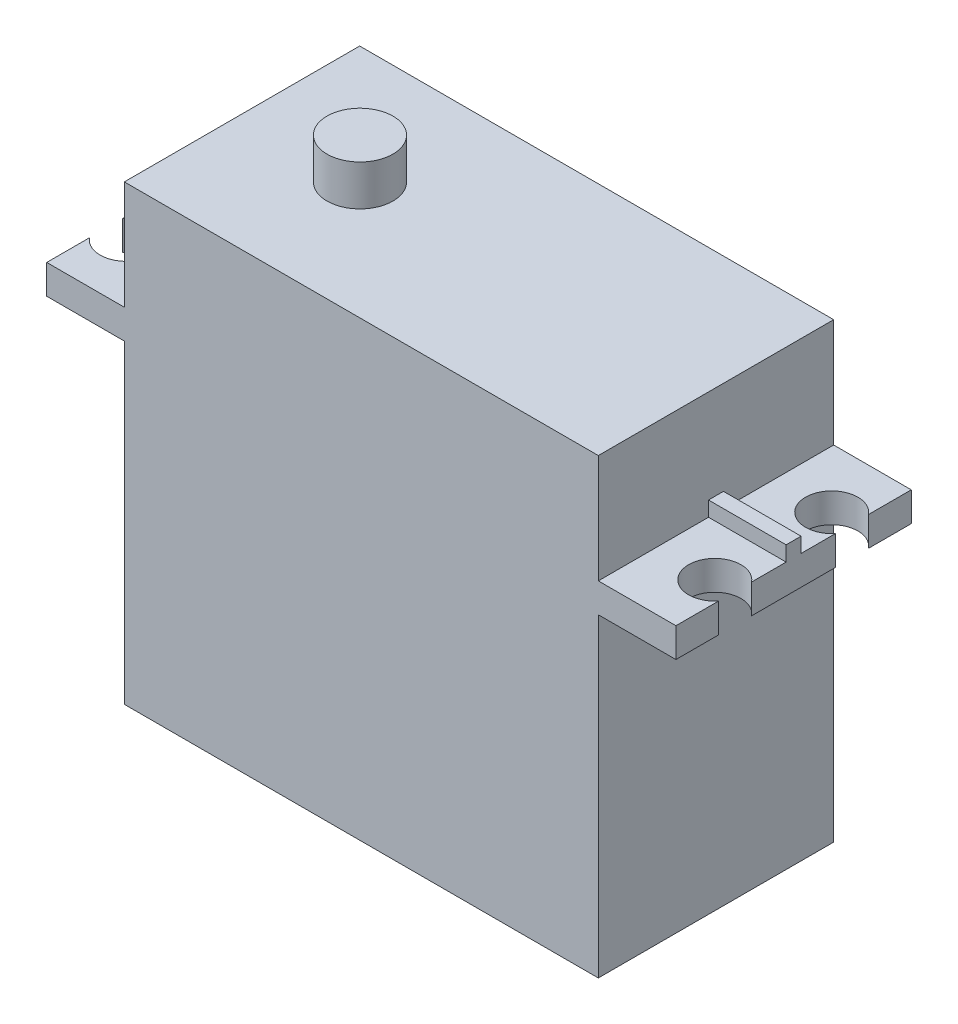
from build123d import *

# Parameters (mm, degrees)
SKETCH2_W               = 40.259
SKETCH2_H               = 19.9898
TOP_OF_HOUSING_DEPTH    = 9.2202
OUTER_EDGE_OF_MOTOR_W   = 53.4416
OUTER_EDGE_OF_MOTOR_H   = 19.9898
MOUNTING_FIN_DEPTH      = 2.4892
SKETCH4_R               = 2.2225
MOUNTING_HOLES_DEPTH    = 30.981848954
SKETCH5_R               = 2.799999988
C24T_SPLINE_DEPTH       = 3.4544
SKETCH2_2_W             = 40.259
SKETCH2_2_H             = 19.9898
BOTTOM_OF_HOUSING_DEPTH = 29.21
SKETCH6_W               = 6.5913
SKETCH6_H               = 1.27
NUB_DEPTH               = 1.27


with BuildPart() as part:
    # Sketch2 → Top of Housing (new body)
    with BuildSketch(Plane(origin=(0, 0, 0), x_dir=(1, 0, 0), z_dir=(0, 1, 0))):
        Rectangle(SKETCH2_W, SKETCH2_H)
    extrude(amount=TOP_OF_HOUSING_DEPTH)

    # Outer Edge of Motor → Mounting Fin (add)
    with BuildSketch(Plane(origin=(0, 0, 0), x_dir=(1, 0, 0), z_dir=(0, 1, 0))):
        Rectangle(OUTER_EDGE_OF_MOTOR_W, OUTER_EDGE_OF_MOTOR_H)
    extrude(amount=-MOUNTING_FIN_DEPTH)

    # Sketch4 → Mounting Holes (cut, through all)
    with BuildSketch(Plane(origin=(0, 0, 0), x_dir=(1, 0, 0), z_dir=(0, 1, 0))):
        with Locations((-24.992246486, 4.9657)):
            Circle(SKETCH4_R)
        with Locations((-24.992246486, -4.9657)):
            Circle(SKETCH4_R)
        with Locations((24.992246486, -4.9657)):
            Circle(SKETCH4_R)
        with Locations((24.992246486, 4.9657)):
            Circle(SKETCH4_R)
    extrude(amount=-MOUNTING_HOLES_DEPTH, mode=Mode.SUBTRACT)

    # Sketch5 → C24T Spline (add)
    with BuildSketch(Plane(origin=(0, 9.2202, 0), x_dir=(1, 0, 0), z_dir=(0, 1, 0))):
        with Locations((-10.1092, 0)):
            Circle(SKETCH5_R)
    extrude(amount=C24T_SPLINE_DEPTH)

    # Sketch2<2> → Bottom of Housing (add)
    with BuildSketch(Plane(origin=(0, 0, 0), x_dir=(1, 0, 0), z_dir=(0, 1, 0))):
        Rectangle(SKETCH2_2_W, SKETCH2_2_H)
    extrude(amount=-BOTTOM_OF_HOUSING_DEPTH)

    # Sketch6 → Nub (add)
    with BuildSketch(Plane(origin=(0, 0, 0), x_dir=(1, 0, 0), z_dir=(0, 1, 0))):
        with Locations((23.42515, 0)):
            Rectangle(SKETCH6_W, SKETCH6_H)
        with Locations((-23.42515, 0)):
            Rectangle(SKETCH6_W, SKETCH6_H)
    extrude(amount=NUB_DEPTH)


solid = part.part
